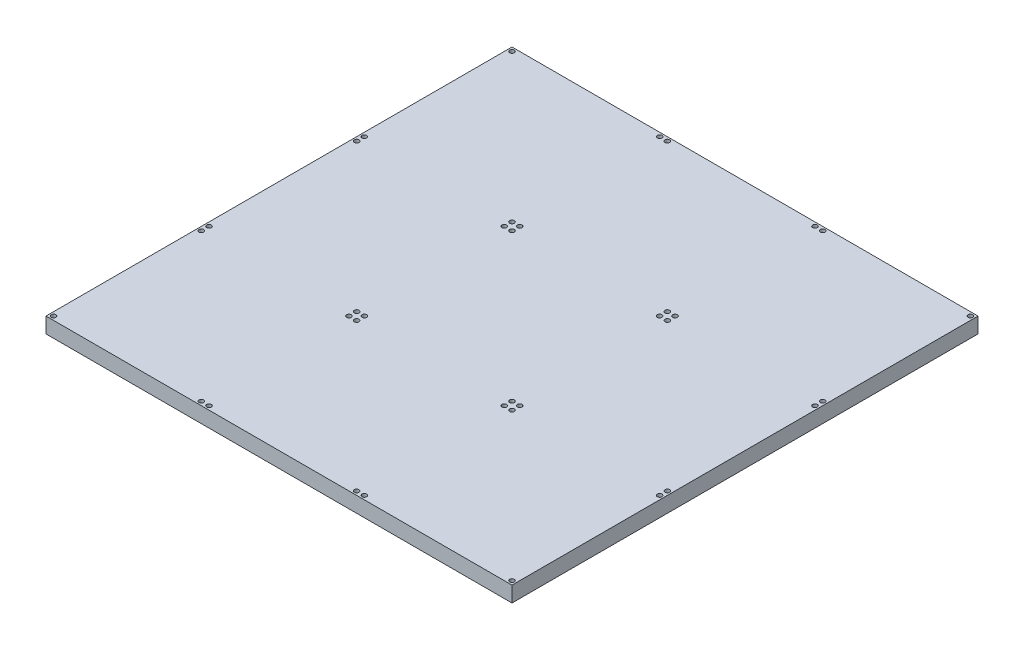
from build123d import *

# Parameters (mm, degrees)
SKETCH1_W            = 50.8
SKETCH1_H            = 50.8
BOSS_EXTRUDE1_DEPTH  = 5.08
SKETCH11_R           = 0.762
CUT_EXTRUDE6_DEPTH   = 2.54
LPATTERN1_COUNT      = 3
LPATTERN1_PITCH      = 50.8
LPATTERN1_COUNT_DIR2 = 3
LPATTERN1_PITCH_DIR2 = 50.8


with BuildPart() as part:
    # Sketch1 → Boss-Extrude1 (new body)
    with BuildSketch(Plane(origin=(0, 0, 0), x_dir=(1, 0, 0), z_dir=(0, 1, 0))):
        Rectangle(SKETCH1_W, SKETCH1_H)
    boss_extrude1 = extrude(amount=BOSS_EXTRUDE1_DEPTH)

    # Sketch11 → Cut-Extrude6 (cut)
    with BuildSketch(Plane(origin=(0, 5.08, 0), x_dir=(1, 0, 0), z_dir=(0, 1, 0))):
        with Locations(Location((-24.142764143, 24.142764143, 0), (0, 0, 270))):
            Circle(SKETCH11_R)
        with Locations(Location((24.142764143, 24.142764143, 0), (0, 0, 90))):
            Circle(SKETCH11_R)
        with Locations(Location((24.142764143, -24.142764143, 0), (0, 0, 270))):
            Circle(SKETCH11_R)
        with Locations(Location((-24.142764143, -24.142764143, 0), (0, 0, 90))):
            Circle(SKETCH11_R)
    cut_extrude6 = extrude(amount=-CUT_EXTRUDE6_DEPTH, mode=Mode.SUBTRACT)

    # LPattern1: Boss-Extrude1, Cut-Extrude6 3 × 3
    with Locations(*[(j * LPATTERN1_PITCH_DIR2, 0, i * LPATTERN1_PITCH) for i in range(LPATTERN1_COUNT) for j in range(LPATTERN1_COUNT_DIR2) if (i, j) != (0, 0)]):
        add(boss_extrude1)
        add(cut_extrude6, mode=Mode.SUBTRACT)


solid = part.part
